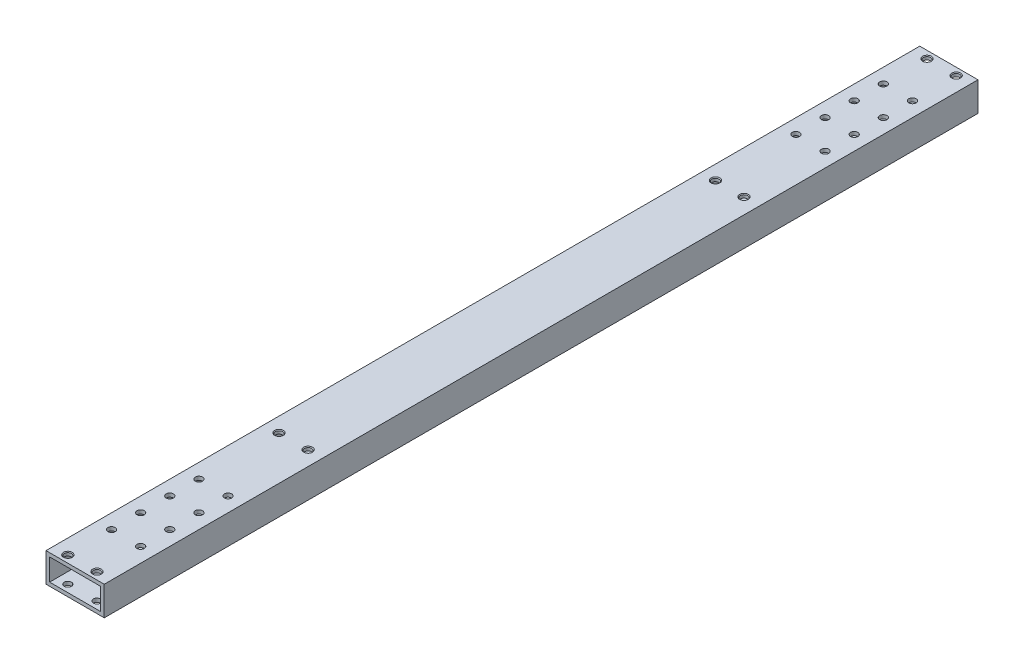
from build123d import *

# Parameters (mm, degrees)
SKETCH1_W                             = 50.8
SKETCH1_H                             = 25.4
SKETCH1_W_2                           = 44.45
SKETCH1_H_2                           = 19.05
BOSS_EXTRUDE1_DEPTH                   = 762
F_1_4_0_25_DIAMETER_HOLE1_D           = 6.35
F_1_4_0_25_DIAMETER_HOLE1_CSINK_D     = 7.62
F_1_4_0_25_DIAMETER_HOLE1_CSINK_ANGLE = 90
F_1_4_0_25_DIAMETER_HOLE2_D           = 6.35
F_1_4_0_25_DIAMETER_HOLE2_CSINK_D     = 7.62
F_1_4_0_25_DIAMETER_HOLE2_CSINK_ANGLE = 90
CUT_EXTRUDE1_DEPTH                    = 765.11373499
CUT_EXTRUDE1_DEPTH_BACK               = 765.11373499
SKETCH9_R                             = 3.175


with BuildPart() as part:
    # Sketch1 → Boss-Extrude1 (new body)
    with BuildSketch(Plane.XY):
        with Locations((25.4, 12.7)):
            Rectangle(SKETCH1_W, SKETCH1_H)
        with Locations((25.4, 12.7)):
            Rectangle(SKETCH1_W_2, SKETCH1_H_2, mode=Mode.SUBTRACT)
    extrude(amount=BOSS_EXTRUDE1_DEPTH)

    # 1/4 (0.25) Diameter Hole1 (through all)
    with Locations(Plane(origin=(0, 25.4, 0), x_dir=(1, 0, 0), z_dir=(0, 1, 0))):
        with Locations((12.7, -6.35), (38.1, -6.35), (12.339930778, -190.5), (37.190506558, -190.5)):
            CounterSinkHole(F_1_4_0_25_DIAMETER_HOLE1_D / 2, F_1_4_0_25_DIAMETER_HOLE1_CSINK_D / 2, counter_sink_angle=F_1_4_0_25_DIAMETER_HOLE1_CSINK_ANGLE)

    # 1/4 (0.25) Diameter Hole2 (through all)
    with Locations(Plane(origin=(0, 25.4, 0), x_dir=(1, 0, 0), z_dir=(0, 1, 0))):
        with Locations((12.7, -755.65), (38.1, -755.65), (38.1, -571.5), (12.7, -571.5)):
            CounterSinkHole(F_1_4_0_25_DIAMETER_HOLE2_D / 2, F_1_4_0_25_DIAMETER_HOLE2_CSINK_D / 2, counter_sink_angle=F_1_4_0_25_DIAMETER_HOLE2_CSINK_ANGLE)

    # Sketch9 → Cut-Extrude1 (cut, two sides: drawn at the far end of the back side and taken through both)
    with BuildSketch(Plane(origin=(0, 25.4, 0), x_dir=(1, 0, 0), z_dir=(0, 1, 0)).offset(-CUT_EXTRUDE1_DEPTH_BACK)):
        with Locations(Location((12.7, -95.25, 0), (0, 0, 270))):
            Circle(SKETCH9_R)
        with Locations(Location((38.1, -95.25, 0), (0, 0, 270))):
            Circle(SKETCH9_R)
        with Locations(Location((12.7, -69.85, 0), (0, 0, 270))):
            Circle(SKETCH9_R)
        with Locations(Location((38.1, -69.85, 0), (0, 0, 270))):
            Circle(SKETCH9_R)
        with Locations(Location((12.7, -44.45, 0), (0, 0, 270))):
            Circle(SKETCH9_R)
        with Locations(Location((38.1, -44.45, 0), (0, 0, 270))):
            Circle(SKETCH9_R)
        with Locations(Location((38.1, -120.65, 0), (0, 0, 270))):
            Circle(SKETCH9_R)
        with Locations(Location((12.7, -120.65, 0), (0, 0, 270))):
            Circle(SKETCH9_R)
        with Locations(Location((12.7, -641.35, 0), (0, 0, 270))):
            Circle(SKETCH9_R)
        with Locations(Location((38.1, -641.35, 0), (0, 0, 270))):
            Circle(SKETCH9_R)
        with Locations(Location((38.1, -666.75, 0), (0, 0, 270))):
            Circle(SKETCH9_R)
        with Locations(Location((12.7, -666.75, 0), (0, 0, 270))):
            Circle(SKETCH9_R)
        with Locations(Location((12.7, -692.15, 0), (0, 0, 270))):
            Circle(SKETCH9_R)
        with Locations(Location((38.1, -692.15, 0), (0, 0, 270))):
            Circle(SKETCH9_R)
        with Locations(Location((38.1, -717.55, 0), (0, 0, 270))):
            Circle(SKETCH9_R)
        with Locations(Location((12.7, -717.55, 0), (0, 0, 270))):
            Circle(SKETCH9_R)
    extrude(amount=CUT_EXTRUDE1_DEPTH + CUT_EXTRUDE1_DEPTH_BACK, mode=Mode.SUBTRACT)


solid = part.part
